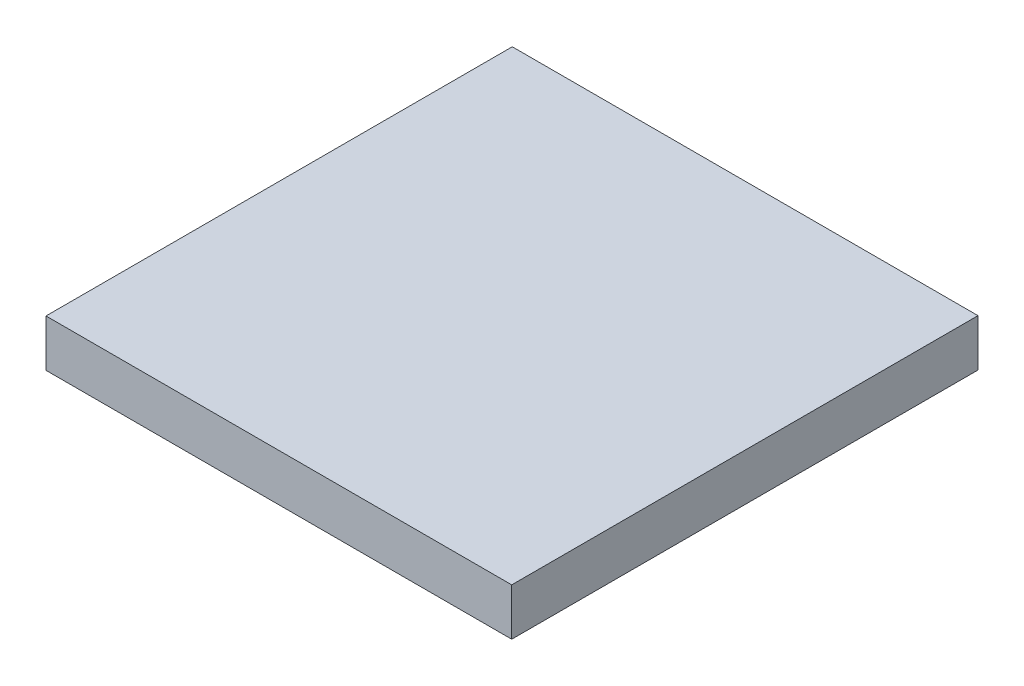
from build123d import *

# Parameters (mm, degrees)
SKETCH1_W           = 29.654008063
SKETCH1_H           = 29.688748119
BOSS_EXTRUDE1_DEPTH = 3
SCALE1_SCALE        = 0.3


with BuildPart() as part:
    # Sketch1 → Boss-Extrude1 (new body)
    with BuildSketch(Plane(origin=(0, 0, 0), x_dir=(1, 0, 0), z_dir=(0, 1, 0))):
        with Locations((14.827004032, -14.84437406)):
            Rectangle(SKETCH1_W, SKETCH1_H)
    extrude(amount=BOSS_EXTRUDE1_DEPTH)


with BuildPart() as part_1:
    # Scale1: scaled about (14.827004032, 1.5, 14.844374059)
    add(part.part.scale(SCALE1_SCALE).moved(Location((10.378902822, 1.05, 10.391061841))))


solid = part_1.part
